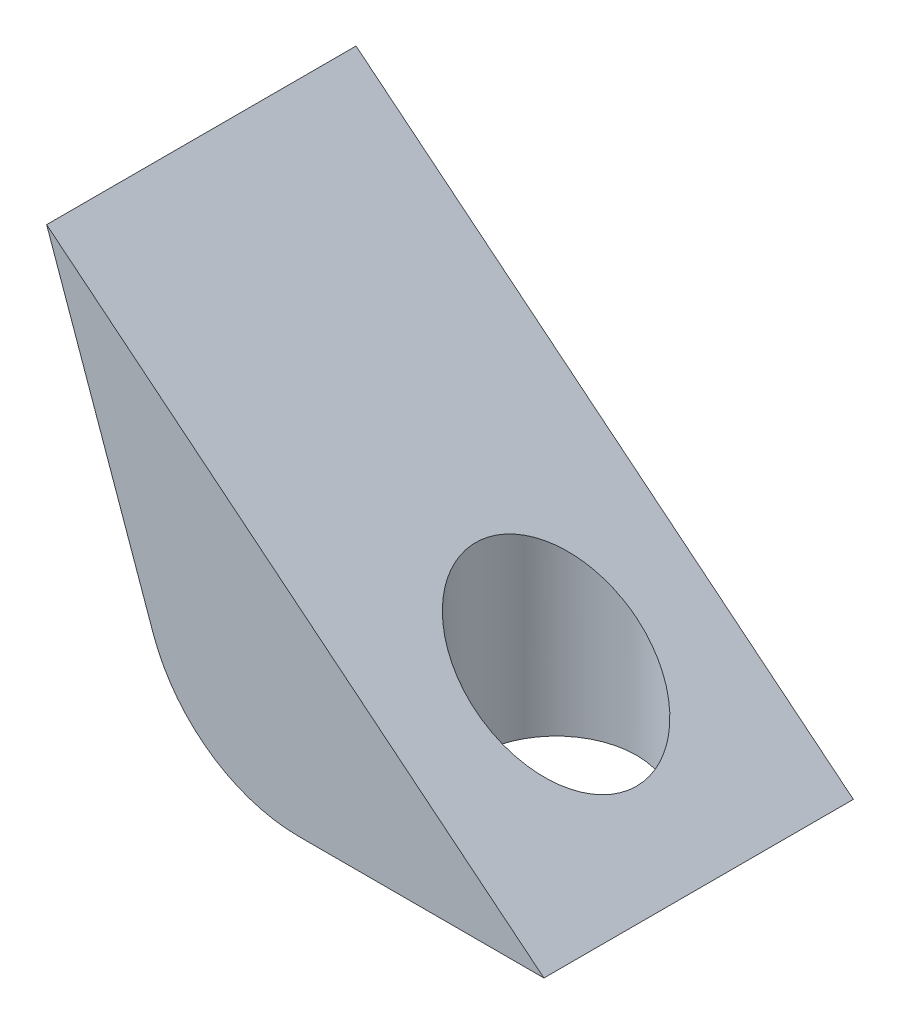
from build123d import *

# Parameters (mm, degrees)
BOSS_EXTRUDE1_DEPTH = 10
FILLET1_R           = 5
SKETCH4_R           = 2.6
CUT_EXTRUDE1_DEPTH  = 10


with BuildPart() as part:
    # Sketch2 → Boss-Extrude1 (new body)
    with BuildSketch(Plane.XY):
        Polygon((0, 0), (11.45, 0), (-4.62309301, 13.05), align=None)
    extrude(amount=BOSS_EXTRUDE1_DEPTH)

    # Fillet1
    fillet1_edges = [part.edges().sort_by_distance(p)[0] for p in [
        (0, 0, 5),
    ]]
    fillet(fillet1_edges, radius=FILLET1_R)

    # Sketch4 → Cut-Extrude1 (cut)
    with BuildSketch(Plane.XZ):
        with Locations(Location((6.713179585, 4.87, 0), (0, 0, 270))):
            Circle(SKETCH4_R)
    extrude(amount=-CUT_EXTRUDE1_DEPTH, mode=Mode.SUBTRACT)


solid = part.part
